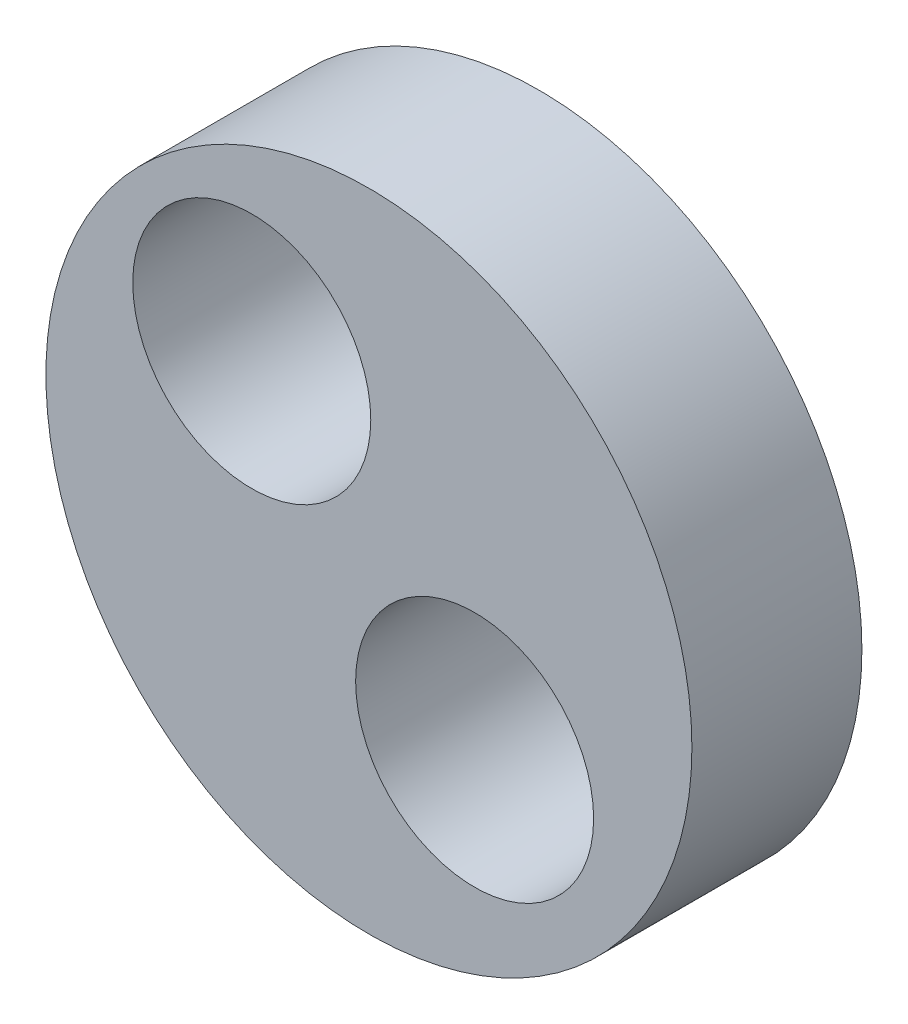
from build123d import *

# Parameters (mm, degrees)
SKETCH1_R          = 12.065
EXTRUDE1_DEPTH     = 6.35
SKETCH2_R          = 4.445
CUT_EXTRUDE1_DEPTH = 25.4
SKETCH3_R          = 4.445
CUT_EXTRUDE2_DEPTH = 25.4


with BuildPart() as part:
    # Sketch1 → Extrude1 (new body)
    with BuildSketch(Plane.XY):
        Circle(SKETCH1_R)
    extrude(amount=EXTRUDE1_DEPTH)

    # Sketch2 → Cut-Extrude1 (cut)
    with BuildSketch(Plane(origin=(0, 0, 0), x_dir=(-1, 0, 0), z_dir=(0, 0, -1))):
        with Locations((4.375522656, 4.601880212)):
            Circle(SKETCH2_R)
    extrude(amount=-CUT_EXTRUDE1_DEPTH, mode=Mode.SUBTRACT)

    # Sketch3 → Cut-Extrude2 (cut)
    with BuildSketch(Plane(origin=(0, 0, 0), x_dir=(-1, 0, 0), z_dir=(0, 0, -1))):
        with Locations((-3.949191744, -4.130993775)):
            Circle(SKETCH3_R)
    extrude(amount=-CUT_EXTRUDE2_DEPTH, mode=Mode.SUBTRACT)


solid = part.part
